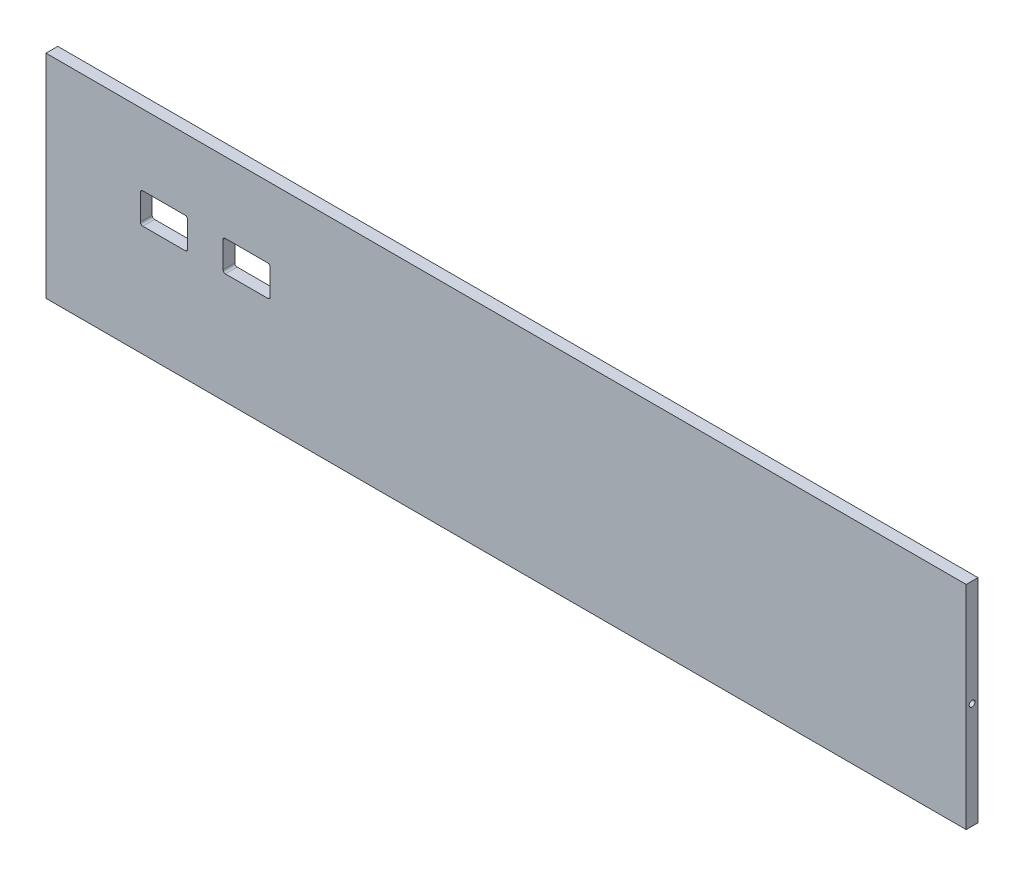
from build123d import *

# Parameters (mm, degrees)
SKETCH1_W           = 390
SKETCH1_H           = 90
BOSS_EXTRUDE2_DEPTH = 5
SKETCH2_R           = 1.25
CUT_EXTRUDE1_DEPTH  = 15
CUT_EXTRUDE2_START  = -15
SKETCH3_R           = 1.25
CUT_EXTRUDE2_DEPTH  = 15
SKETCH4_R           = 1.25
CUT_EXTRUDE3_DEPTH  = 15


with BuildPart() as part:
    # Sketch1 → Boss-Extrude2 (new body)
    with BuildSketch(Plane.XY):
        with Locations((195, 45)):
            Rectangle(SKETCH1_W, SKETCH1_H)
        with BuildLine():
            Line((41, 60), (59, 60))
            ThreePointArc((59, 60), (59.707106781, 59.707106781), (60, 59))
            Line((60, 59), (60, 48))
            ThreePointArc((60, 48), (59.707106781, 47.292893219), (59, 47))
            Line((59, 47), (41, 47))
            ThreePointArc((41, 47), (40.292893219, 47.292893219), (40, 48))
            Line((40, 48), (40, 59))
            ThreePointArc((40, 59), (40.292893219, 59.707106781), (41, 60))
        make_face(mode=Mode.SUBTRACT)
        with BuildLine():
            Line((76, 60), (94, 60))
            ThreePointArc((94, 60), (94.707106781, 59.707106781), (95, 59))
            Line((95, 59), (95, 48))
            ThreePointArc((95, 48), (94.707106781, 47.292893219), (94, 47))
            Line((94, 47), (76, 47))
            ThreePointArc((76, 47), (75.292893219, 47.292893219), (75, 48))
            Line((75, 48), (75, 59))
            ThreePointArc((75, 59), (75.292893219, 59.707106781), (76, 60))
        make_face(mode=Mode.SUBTRACT)
    extrude(amount=BOSS_EXTRUDE2_DEPTH)

    # Sketch2 → Cut-Extrude1 (cut)
    with BuildSketch(Plane.ZY):
        with Locations((2.5, 45)):
            Circle(SKETCH2_R)
    extrude(amount=-CUT_EXTRUDE1_DEPTH, mode=Mode.SUBTRACT)

    # Sketch3 → Cut-Extrude2 (cut)
    with BuildSketch(Plane(origin=(390, 0, 0), x_dir=(0, 0, -1), z_dir=(1, 0, 0)).offset(CUT_EXTRUDE2_START)):
        with Locations(Location((-2.5, 45, 0), (0, 0, 180))):
            Circle(SKETCH3_R)
    extrude(amount=CUT_EXTRUDE2_DEPTH, mode=Mode.SUBTRACT)

    # Sketch4 → Cut-Extrude3 (cut)
    with BuildSketch(Plane.XZ):
        with Locations(Location((35, 2.5, 0), (0, 0, 270))):
            Circle(SKETCH4_R)
        with Locations(Location((355, 2.5, 0), (0, 0, 270))):
            Circle(SKETCH4_R)
    extrude(amount=-CUT_EXTRUDE3_DEPTH, mode=Mode.SUBTRACT)


solid = part.part
